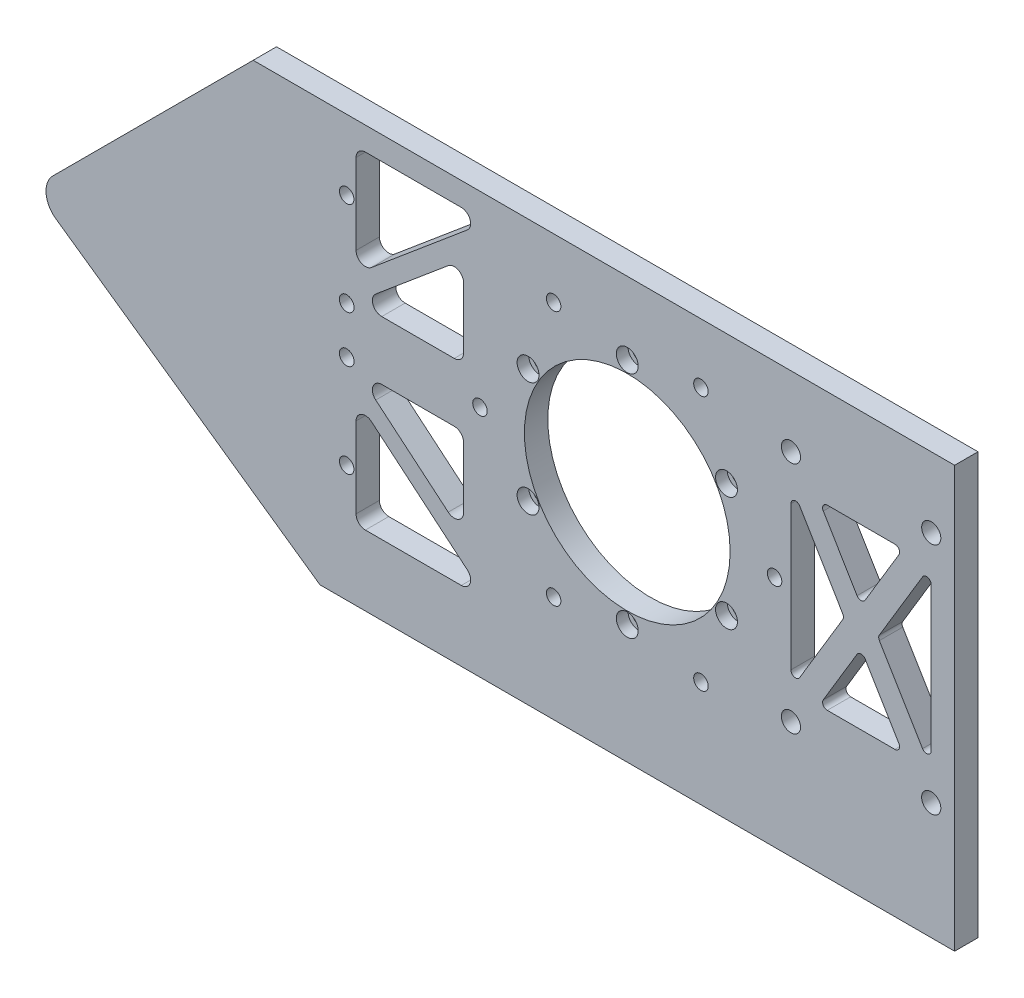
from build123d import *

# Parameters (mm, degrees)
SKETCH_1_W             = 150
SKETCH_1_H             = 80
SKETCH_1_R             = 1.3
SKETCH_1_R_2           = 22
EXTRUDE_1_DEPTH        = 5
SKETCH_2_R             = 2.34
CUT_EXTRUDE_1_DEPTH    = 2.5
SKETCH_3_R             = 1.55
SKETCH_3_R_2           = 1.582849294
CUT_EXTRUDE_3_DEPTH    = 12.5
CUT_EXTRUDE_5_DEPTH    = 8
FILLET_3_R             = 2
FILLET_3_OF_MIRROR_2_R = 2
EXTRUDE_4_DEPTH        = 5
FILLET_5_R             = 5
SKETCH_11_R            = 1.55
CUT_EXTRUDE_7_DEPTH    = 25
SKETCH_12_R            = 2.05
CUT_EXTRUDE_8_DEPTH    = 10
CUT_EXTRUDE_9_DEPTH    = 10
FILLET_6_R             = 1
EXTRUDE_5_DEPTH        = 5


with BuildPart() as part:
    # 草图1 → 凸台-拉伸1 (new body)
    with BuildSketch(Plane.XY):
        with Locations((-5, 0)):
            Rectangle(SKETCH_1_W, SKETCH_1_H)
        with Locations((0, -24.5)):
            Circle(SKETCH_1_R, mode=Mode.SUBTRACT)
        with Locations((-21.217622393, -12.25)):
            Circle(SKETCH_1_R, mode=Mode.SUBTRACT)
        with Locations((-21.217622393, 12.25)):
            Circle(SKETCH_1_R, mode=Mode.SUBTRACT)
        Circle(SKETCH_1_R_2, mode=Mode.SUBTRACT)
        with Locations((0, 24.5)):
            Circle(SKETCH_1_R, mode=Mode.SUBTRACT)
        with Locations((21.217622393, 12.25)):
            Circle(SKETCH_1_R, mode=Mode.SUBTRACT)
        with Locations((21.217622393, -12.25)):
            Circle(SKETCH_1_R, mode=Mode.SUBTRACT)
    extrude(amount=EXTRUDE_1_DEPTH)

    # 草图2 → 切除-拉伸1 (cut)
    with BuildSketch(Plane.XY.offset(5)):
        with Locations((-21.217622393, 12.25)):
            Circle(SKETCH_2_R)
        with Locations((0, 24.5)):
            Circle(SKETCH_2_R)
        with Locations((21.217622393, 12.25)):
            Circle(SKETCH_2_R)
        with Locations((21.217622393, -12.25)):
            Circle(SKETCH_2_R)
        with Locations((0, -24.5)):
            Circle(SKETCH_2_R)
        with Locations((-21.217622393, -12.25)):
            Circle(SKETCH_2_R)
    extrude(amount=-CUT_EXTRUDE_1_DEPTH, mode=Mode.SUBTRACT)

    # 草图3 → 切除-拉伸3 (cut)
    with BuildSketch(Plane.XY.offset(5)):
        with Locations((-60, -25)):
            Circle(SKETCH_3_R)
        with Locations((-60, -5)):
            Circle(SKETCH_3_R_2)
        with Locations((-60, 25)):
            Circle(SKETCH_3_R)
        with Locations((-60, 5)):
            Circle(SKETCH_3_R_2)
    extrude(amount=-CUT_EXTRUDE_3_DEPTH, mode=Mode.SUBTRACT)

    # 草图4 → 切除-拉伸5 (cut)
    with BuildSketch(Plane.XY.offset(5)):
        Polygon((-58, 35), (-30, 35), (-58, 11.505210327), align=None)
        Polygon((-35, 25.582872687), (-58, 6.28358117), (-35, 6.28358117), align=None)
    cut_extrude_5 = extrude(amount=-CUT_EXTRUDE_5_DEPTH, mode=Mode.SUBTRACT)

    # 圆角3
    fillet_3_edges = [part.edges().sort_by_distance(p)[0] for p in [
        (-35, 6.28358117, 2.5),
        (-58, 6.28358117, 2.5),
        (-35, 25.582872687, 2.5),
        (-30, 35, 2.5),
        (-58, 11.505210327, 2.5),
        (-58, 35, 2.5),
    ]]
    fillet(fillet_3_edges, radius=FILLET_3_R)

    # 镜向2: 切除-拉伸5 across plane
    add(cut_extrude_5.mirror(Plane.ZX), mode=Mode.SUBTRACT)

    # 圆角3 of 镜向2
    fillet_3_of_mirror_2_edges = [part.edges().sort_by_distance(p)[0] for p in [
        (-35, -6.28358117, 2.5),
        (-58, -6.28358117, 2.5),
        (-35, -25.582872687, 2.5),
        (-30, -35, 2.5),
        (-58, -11.505210327, 2.5),
        (-58, -35, 2.5),
    ]]
    fillet(fillet_3_of_mirror_2_edges, radius=FILLET_3_OF_MIRROR_2_R)

    # 草图10 → 凸台-拉伸4 (add)
    with BuildSketch(Plane.XY.offset(5)):
        Polygon((-80, -40), (-127.053079228, -7.053079228), (-80, 40), align=None)
    extrude(amount=-EXTRUDE_4_DEPTH)

    # 圆角5
    fillet_5_edges = [part.edges().sort_by_distance(p)[0] for p in [
        (-127.053079228, -7.053079228, 2.5),
    ]]
    fillet(fillet_5_edges, radius=FILLET_5_R)

    # 草图11 → 切除-拉伸7 (cut)
    with BuildSketch(Plane.XY.offset(5)):
        with Locations((-15.75, 27.279800219)):
            Circle(SKETCH_11_R)
        with Locations((15.75, 27.279800219)):
            Circle(SKETCH_11_R)
        with Locations((31.5, 0)):
            Circle(SKETCH_11_R)
        with Locations((15.75, -27.279800219)):
            Circle(SKETCH_11_R)
        with Locations((-15.75, -27.279800219)):
            Circle(SKETCH_11_R)
        with Locations((-31.5, 0)):
            Circle(SKETCH_11_R)
    extrude(amount=-CUT_EXTRUDE_7_DEPTH, mode=Mode.SUBTRACT)

    # 草图12 → 切除-拉伸8 (cut)
    with BuildSketch(Plane.XY.offset(5)):
        with Locations((35, 25)):
            Circle(SKETCH_12_R)
        with Locations((65, 25)):
            Circle(SKETCH_12_R)
        with Locations((65, -25)):
            Circle(SKETCH_12_R)
        with Locations((35, -25)):
            Circle(SKETCH_12_R)
    extrude(amount=-CUT_EXTRUDE_8_DEPTH, mode=Mode.SUBTRACT)

    # 草图13 → 切除-拉伸9 (cut)
    with BuildSketch(Plane.XY.offset(5)):
        Polygon((35, 19), (35, -19), (46.4, 0), align=None)
        Polygon((65, -19), (53.6, 0), (65, 19), align=None)
        Polygon((41, 19), (50, 4), (59, 19), align=None)
        Polygon((50, -4), (59, -19), (41, -19), align=None)
    extrude(amount=-CUT_EXTRUDE_9_DEPTH, mode=Mode.SUBTRACT)

    # 圆角6
    fillet_6_edges = [part.edges().sort_by_distance(p)[0] for p in [
        (41, 19, 2.5),
        (59, 19, 2.5),
        (50, 4, 2.5),
        (65, 19, 2.5),
        (65, -19, 2.5),
        (53.6, 0, 2.5),
        (41, -19, 2.5),
        (50, -4, 2.5),
        (59, -19, 2.5),
        (35, 19, 2.5),
        (46.4, 0, 2.5),
        (35, -19, 2.5),
    ]]
    fillet(fillet_6_edges, radius=FILLET_6_R)

    # 草图14 → 凸台-拉伸5 (add)
    with BuildSketch(Plane.XY.offset(5)):
        Polygon((-80, -40), (-65.718519933, -50), (70, -50), (70, -40), align=None)
    extrude(amount=-EXTRUDE_5_DEPTH)


solid = part.part
